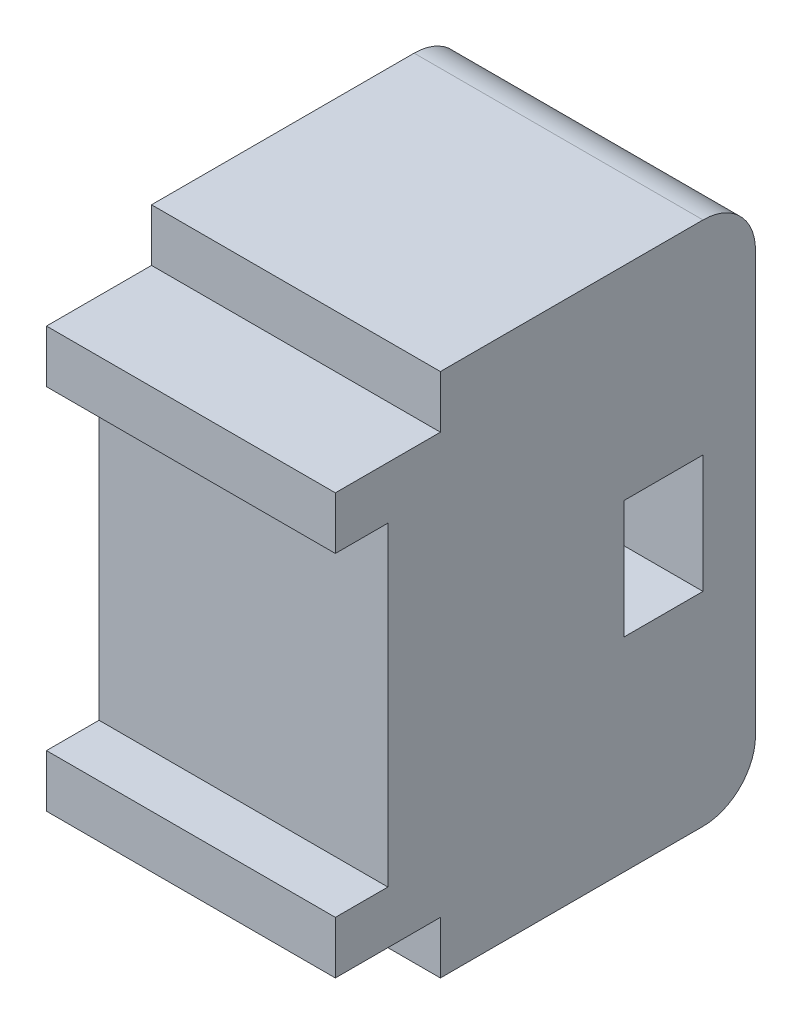
from build123d import *

# Parameters (mm, degrees)
SKETCH1_W           = 20
SKETCH1_H           = 12
BOSS_EXTRUDE1_DEPTH = 11
SKETCH5_W           = 16
SKETCH5_H           = 11
BOSS_EXTRUDE2_DEPTH = 8
FILLET1_R           = 2
SKETCH7_W           = 4.5
SKETCH7_H           = 3
CUT_EXTRUDE1_DEPTH  = 15
SKETCH9_W           = 11
SKETCH9_H           = 2
BOSS_EXTRUDE4_DEPTH = 2


with BuildPart() as part:
    # Sketch1 → Boss-Extrude1 (new body)
    with BuildSketch(Plane.YZ):
        Rectangle(SKETCH1_W, SKETCH1_H)
    extrude(amount=BOSS_EXTRUDE1_DEPTH)

    # Sketch5 → Boss-Extrude2 (add)
    with BuildSketch(Plane(origin=(0, 0, 0), x_dir=(0, 1, 0), z_dir=(0, 0, 1))):
        with Locations((0, -5.5)):
            Rectangle(SKETCH5_W, SKETCH5_H)
    extrude(amount=BOSS_EXTRUDE2_DEPTH)

    # Fillet1
    fillet1_edges = [part.edges().sort_by_distance(p)[0] for p in [
        (5.5, 10, -6),
        (5.5, -10, -6),
    ]]
    fillet(fillet1_edges, radius=FILLET1_R)

    # Sketch7 → Cut-Extrude1 (cut)
    with BuildSketch(Plane.YZ):
        with Locations((0, -2.5)):
            Rectangle(SKETCH7_W, SKETCH7_H)
    extrude(amount=CUT_EXTRUDE1_DEPTH, mode=Mode.SUBTRACT)

    # Sketch9 → Boss-Extrude4 (add)
    with BuildSketch(Plane.XY.offset(8)):
        with Locations((5.5, 7)):
            Rectangle(SKETCH9_W, SKETCH9_H)
        with Locations((5.5, -7)):
            Rectangle(SKETCH9_W, SKETCH9_H)
    extrude(amount=BOSS_EXTRUDE4_DEPTH)


solid = part.part
